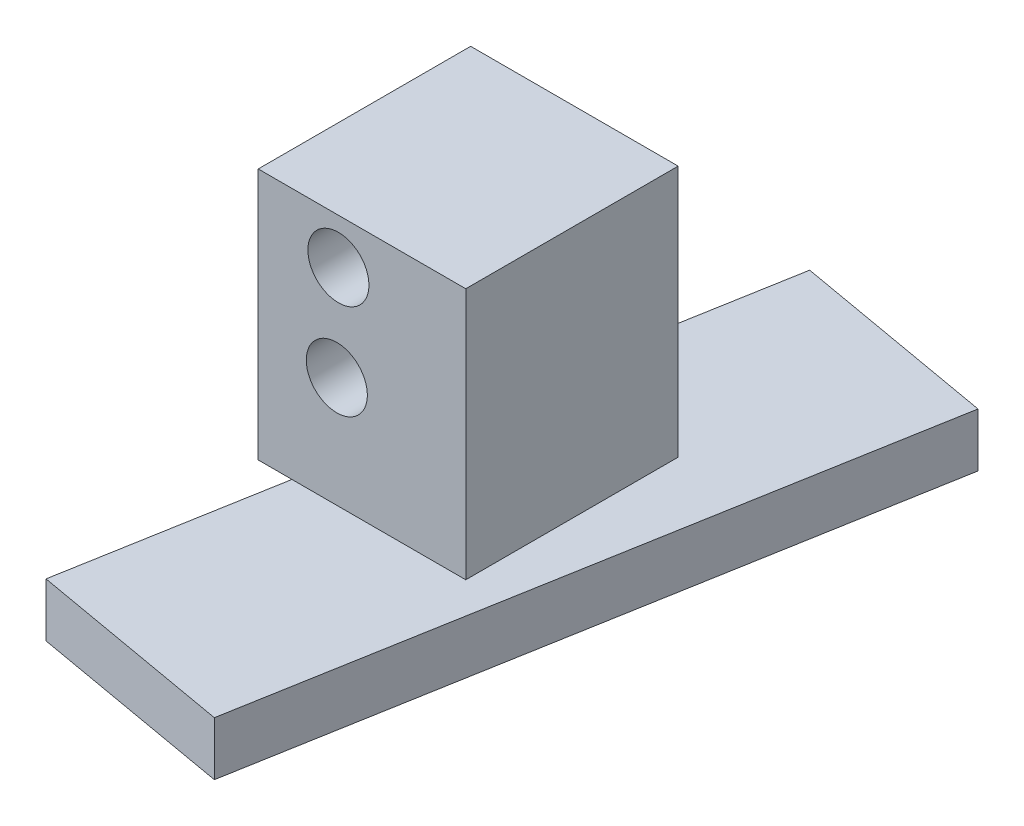
from build123d import *

# Parameters (mm, degrees)
SKETCH1_W           = 21.59
SKETCH1_H           = 26.222681286
SKETCH1_R           = 3.175
BOSS_EXTRUDE1_DEPTH = 22.098
BOSS_EXTRUDE2_DEPTH = 5.588


with BuildPart() as part:
    # Sketch1 → Boss-Extrude1 (new body)
    with BuildSketch(Plane.XY):
        with Locations((439.785229177, 122.101713944)):
            Rectangle(SKETCH1_W, SKETCH1_H)
        with Locations(Location((437.331098026, 130.5, 0), (0, 0, 180))):
            Circle(SKETCH1_R, mode=Mode.SUBTRACT)
        with Locations(Location((437.164813366, 120.5, 0), (0, 0, 180))):
            Circle(SKETCH1_R, mode=Mode.SUBTRACT)
    extrude(amount=BOSS_EXTRUDE1_DEPTH)

    # Sketch2 → Boss-Extrude2 (add)
    with BuildSketch(Plane(origin=(0, 108.990373301, 0), x_dir=(1, 0, 0), z_dir=(0, 1, 0))):
        Polygon((428.662736998, -43.850251272), (440.571529023, 23.68786443), (461.83352841, 19.938800274), (449.924736386, -47.599315428), align=None)
    extrude(amount=-BOSS_EXTRUDE2_DEPTH)


solid = part.part
